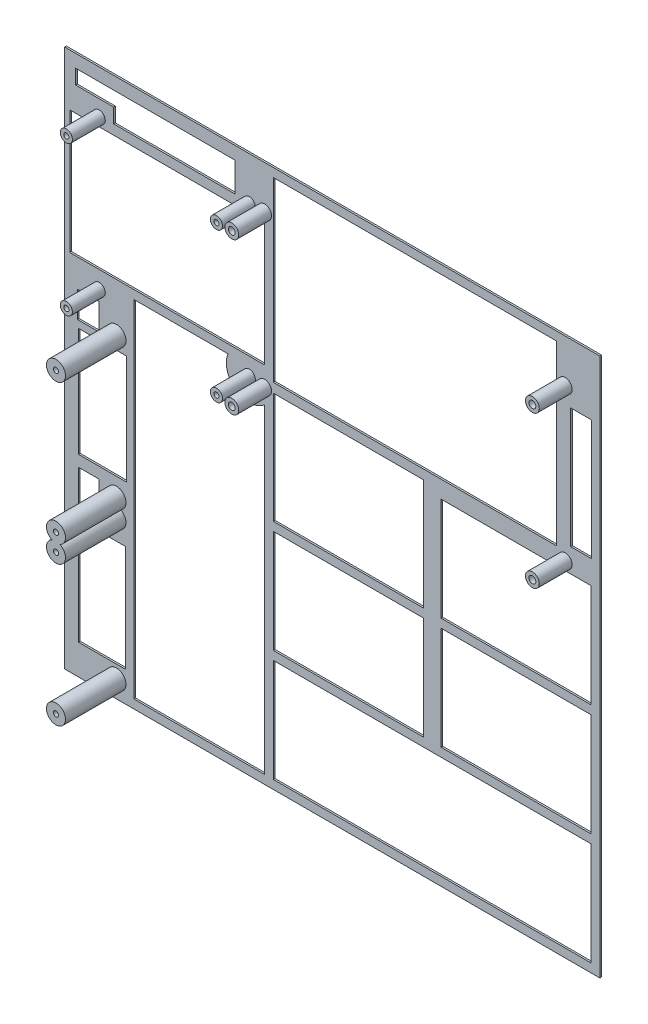
from build123d import *

# Parameters (mm, degrees)
SKETCH2_W           = 309.367
SKETCH2_H           = 311.36
BOSS_EXTRUDE1_DEPTH = 1
SKETCH2_3_R         = 3.5
SKETCH2_3_R_2       = 1.5
SKETCH2_3_R_3       = 4
SKETCH2_3_R_4       = 2
EXTRUDE_THIN1_DEPTH = 20
SKETCH3_R           = 5.5
SKETCH3_R_2         = 1.5
EXTRUDE_THIN2_DEPTH = 35
SKETCH4_W           = 112.631
SKETCH4_H           = 71.36
SKETCH4_W_2         = 163.736
SKETCH4_H_2         = 102.52
SKETCH4_W_3         = 86.868
SKETCH4_H_3         = 64.182745073
SKETCH4_H_4         = 59.613333333
SKETCH4_H_5         = 59.613333334
SKETCH4_W_4         = 183.736
SKETCH4_W_5         = 12.079044756
SKETCH4_H_6         = 69.461977069
SKETCH4_W_6         = 27.221531775
SKETCH4_H_7         = 61.475693889
SKETCH4_W_7         = 27.828675931
SKETCH4_H_8         = 63.062552752
SKETCH4_W_8         = 12
SKETCH4_H_9         = 18.502345826
SKETCH4_W_9         = 12.578204099
SKETCH4_H_10        = 15.179819782
CUT_EXTRUDE1_DEPTH  = 354.494357365


with BuildPart() as part:
    # Sketch2 → Boss-Extrude1 (new body)
    with BuildSketch(Plane.XY):
        with Locations((134.6835, -44.32)):
            Rectangle(SKETCH2_W, SKETCH2_H)
    extrude(amount=BOSS_EXTRUDE1_DEPTH)

    # Sketch2<3> → Extrude-Thin1 (add)
    # profile 1 of 8: a face of its own
    with BuildSketch(Plane.XY):
        with Locations((0, 86.36)):
            Circle(SKETCH2_3_R)
        with Locations((0, 86.36)):
            Circle(SKETCH2_3_R_2, mode=Mode.SUBTRACT)
    # profile 2 of 8: a face of its own
    with BuildSketch(Plane.XY):
        with Locations((86.741, 86.36)):
            Circle(SKETCH2_3_R)
        with Locations((86.741, 86.36)):
            Circle(SKETCH2_3_R_2, mode=Mode.SUBTRACT)
    # profile 3 of 8: a face of its own
    with BuildSketch(Plane.XY):
        Circle(SKETCH2_3_R)
        Circle(SKETCH2_3_R_2, mode=Mode.SUBTRACT)
    # profile 4 of 8: a face of its own
    with BuildSketch(Plane.XY):
        with Locations((86.741, 0)):
            Circle(SKETCH2_3_R)
        with Locations((86.741, 0)):
            Circle(SKETCH2_3_R_2, mode=Mode.SUBTRACT)
    # profile 5 of 8: a face of its own
    with BuildSketch(Plane.XY):
        with Locations((95.631, -1.16)):
            Circle(SKETCH2_3_R_3)
        with Locations((95.631, -1.16)):
            Circle(SKETCH2_3_R_4, mode=Mode.SUBTRACT)
    # profile 6 of 8: a face of its own
    with BuildSketch(Plane.XY):
        with Locations((95.631, 86.61)):
            Circle(SKETCH2_3_R_3)
        with Locations((95.631, 86.61)):
            Circle(SKETCH2_3_R_4, mode=Mode.SUBTRACT)
    # profile 7 of 8: a face of its own
    with BuildSketch(Plane.XY):
        with Locations((269.367, 86.61)):
            Circle(SKETCH2_3_R_3)
        with Locations((269.367, 86.61)):
            Circle(SKETCH2_3_R_4, mode=Mode.SUBTRACT)
    # profile 8 of 8: a face of its own
    with BuildSketch(Plane.XY):
        with Locations((269.367, -1.16)):
            Circle(SKETCH2_3_R_3)
        with Locations((269.367, -1.16)):
            Circle(SKETCH2_3_R_4, mode=Mode.SUBTRACT)
    extrude(amount=EXTRUDE_THIN1_DEPTH)

    # Sketch3 → Extrude-Thin2 (add)
    # profile 1 of 4: a face of its own
    with BuildSketch(Plane.XY.offset(1)):
        with Locations((10, -18)):
            Circle(SKETCH3_R)
        with Locations((10, -18)):
            Circle(SKETCH3_R_2, mode=Mode.SUBTRACT)
    # profile 2 of 4: a face of its own
    with BuildSketch(Plane.XY.offset(1)):
        with Locations((10, -99)):
            Circle(SKETCH3_R)
        with Locations((10, -99)):
            Circle(SKETCH3_R_2, mode=Mode.SUBTRACT)
    # profile 3 of 4: a face of its own
    with BuildSketch(Plane.XY.offset(1)):
        with Locations((10, -109)):
            Circle(SKETCH3_R)
        with Locations((10, -109)):
            Circle(SKETCH3_R_2, mode=Mode.SUBTRACT)
    # profile 4 of 4: a face of its own
    with BuildSketch(Plane.XY.offset(1)):
        with Locations((10, -190)):
            Circle(SKETCH3_R)
        with Locations((10, -190)):
            Circle(SKETCH3_R_2, mode=Mode.SUBTRACT)
    extrude(amount=EXTRUDE_THIN2_DEPTH)

    # Sketch4 → Cut-Extrude1 (cut, through all)
    with BuildSketch(Plane.XY.offset(1)):
        with Locations((39.3155, 45.68)):
            Rectangle(SKETCH4_W, SKETCH4_H)
        with Locations((182.499, 55.1)):
            Rectangle(SKETCH4_W_2, SKETCH4_H_2)
        with Locations((144.065, -33.681960797)):
            Rectangle(SKETCH4_W_3, SKETCH4_H_3)
        with Locations((240.933, -35.966666667)):
            Rectangle(SKETCH4_W_3, SKETCH4_H_4)
        with Locations((144.065, -100.58)):
            Rectangle(SKETCH4_W_3, SKETCH4_H_5)
        with Locations((240.933, -100.58)):
            Rectangle(SKETCH4_W_3, SKETCH4_H_5)
        with BuildLine():
            Line((20, 5), (74.440730541, 5))
            ThreePointArc((74.440730541, 5), (79.116741885, -10.87047915), (95.631, -9.862278071))
            Line((95.631, -9.862278071), (95.631, -195))
            Line((95.631, -195), (20, -195))
            Line((20, -195), (20, 5))
        make_face()
        with Locations((192.499, -165.193333333)):
            Rectangle(SKETCH4_W_4, SKETCH4_H_4)
        Polygon((8.304053723, 103.951159657), (78.368777901, 103.951159657), (78.368777901, 87.023616947), (8.304053723, 87.023616947), (8.304053723, 95.487388302), (-13.644840997, 95.487388302), (-13.644840997, 103.951159657), align=None)
        with Locations((278.577905398, 42.236447079)):
            Rectangle(SKETCH4_W_5, SKETCH4_H_6)
        with Locations((1.610765888, -151.832307187)):
            Rectangle(SKETCH4_W_6, SKETCH4_H_7)
        with Locations((1.914337966, -57.002403063)):
            Rectangle(SKETCH4_W_7, SKETCH4_H_8)
        with Locations((-6, -104.251172913)):
            Rectangle(SKETCH4_W_8, SKETCH4_H_9)
        with Locations((-6.28910205, -13.749909891)):
            Rectangle(SKETCH4_W_9, SKETCH4_H_10)
    extrude(amount=-CUT_EXTRUDE1_DEPTH, mode=Mode.SUBTRACT)


solid = part.part
